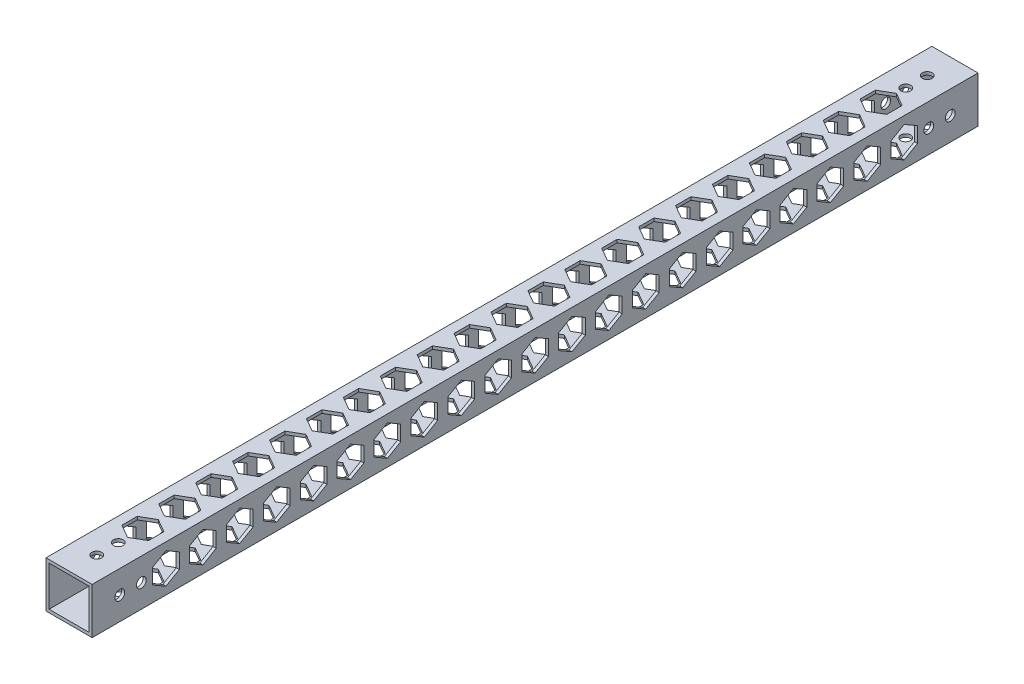
from build123d import *

# Parameters (mm, degrees)
SKETCH_1_W          = 15
SKETCH_1_H          = 15
SKETCH_1_W_2        = 13
SKETCH_1_H_2        = 13
EXTRUDE_1_DEPTH     = 288
SKETCH_2_R          = 1.6
CUT_EXTRUDE_1_DEPTH = 15
SKETCH_3_R          = 1.6
CUT_EXTRUDE_2_DEPTH = 15


with BuildPart() as part:
    # 草图1 → 凸台-拉伸1 (new body)
    with BuildSketch(Plane.XY):
        Rectangle(SKETCH_1_W, SKETCH_1_H)
        Rectangle(SKETCH_1_W_2, SKETCH_1_H_2, mode=Mode.SUBTRACT)
    extrude(amount=EXTRUDE_1_DEPTH)

    # 草图2 → 切除-拉伸1 (cut)
    with BuildSketch(Plane(origin=(0, 7.5, 0), x_dir=(1, 0, 0), z_dir=(0, 1, 0))):
        with Locations(Location((0, -9, 0), (0, 0, 180))):
            Circle(SKETCH_2_R)
        with Locations(Location((0, -279, 0), (0, 0, 180))):
            Circle(SKETCH_2_R)
        with Locations(Location((0, -16, 0), (0, 0, 180))):
            Circle(SKETCH_2_R)
        with Locations(Location((0, -272, 0), (0, 0, 180))):
            Circle(SKETCH_2_R)
        Polygon((0, -151), (-4.330127019, -153.5), (-4.330127019, -158.5), (0, -161), (4.330127019, -158.5), (4.330127019, -153.5), align=None)
        Polygon((0, -139), (-4.330127019, -141.5), (-4.330127019, -146.5), (0, -149), (4.330127019, -146.5), (4.330127019, -141.5), align=None)
        Polygon((0, -163), (-4.330127019, -165.5), (-4.330127019, -170.5), (0, -173), (4.330127019, -170.5), (4.330127019, -165.5), align=None)
        Polygon((0, -175), (-4.330127019, -177.5), (-4.330127019, -182.5), (0, -185), (4.330127019, -182.5), (4.330127019, -177.5), align=None)
        Polygon((0, -187), (-4.330127019, -189.5), (-4.330127019, -194.5), (0, -197), (4.330127019, -194.5), (4.330127019, -189.5), align=None)
        Polygon((0, -199), (-4.330127019, -201.5), (-4.330127019, -206.5), (0, -209), (4.330127019, -206.5), (4.330127019, -201.5), align=None)
        Polygon((0, -211), (-4.330127019, -213.5), (-4.330127019, -218.5), (0, -221), (4.330127019, -218.5), (4.330127019, -213.5), align=None)
        Polygon((0, -223), (-4.330127019, -225.5), (-4.330127019, -230.5), (0, -233), (4.330127019, -230.5), (4.330127019, -225.5), align=None)
        Polygon((0, -235), (-4.330127019, -237.5), (-4.330127019, -242.5), (0, -245), (4.330127019, -242.5), (4.330127019, -237.5), align=None)
        Polygon((0, -247), (-4.330127019, -249.5), (-4.330127019, -254.5), (0, -257), (4.330127019, -254.5), (4.330127019, -249.5), align=None)
        Polygon((0, -259), (-4.330127019, -261.5), (-4.330127019, -266.5), (0, -269), (4.330127019, -266.5), (4.330127019, -261.5), align=None)
        Polygon((0, -127), (-4.330127019, -129.5), (-4.330127019, -134.5), (0, -137), (4.330127019, -134.5), (4.330127019, -129.5), align=None)
        Polygon((0, -115), (-4.330127019, -117.5), (-4.330127019, -122.5), (0, -125), (4.330127019, -122.5), (4.330127019, -117.5), align=None)
        Polygon((0, -103), (-4.330127019, -105.5), (-4.330127019, -110.5), (0, -113), (4.330127019, -110.5), (4.330127019, -105.5), align=None)
        Polygon((0, -91), (-4.330127019, -93.5), (-4.330127019, -98.5), (0, -101), (4.330127019, -98.5), (4.330127019, -93.5), align=None)
        Polygon((0, -79), (-4.330127019, -81.5), (-4.330127019, -86.5), (0, -89), (4.330127019, -86.5), (4.330127019, -81.5), align=None)
        Polygon((0, -67), (-4.330127019, -69.5), (-4.330127019, -74.5), (0, -77), (4.330127019, -74.5), (4.330127019, -69.5), align=None)
        Polygon((0, -55), (-4.330127019, -57.5), (-4.330127019, -62.5), (0, -65), (4.330127019, -62.5), (4.330127019, -57.5), align=None)
        Polygon((0, -43), (-4.330127019, -45.5), (-4.330127019, -50.5), (0, -53), (4.330127019, -50.5), (4.330127019, -45.5), align=None)
        Polygon((0, -31), (-4.330127019, -33.5), (-4.330127019, -38.5), (0, -41), (4.330127019, -38.5), (4.330127019, -33.5), align=None)
        Polygon((0, -19), (-4.330127019, -21.5), (-4.330127019, -26.5), (0, -29), (4.330127019, -26.5), (4.330127019, -21.5), align=None)
    extrude(amount=-CUT_EXTRUDE_1_DEPTH, mode=Mode.SUBTRACT)

    # 草图3 → 切除-拉伸2 (cut)
    with BuildSketch(Plane.ZY.offset(7.5)):
        with Locations((9, 0)):
            Circle(SKETCH_3_R)
        with Locations((279, 0)):
            Circle(SKETCH_3_R)
        with Locations((272, 0)):
            Circle(SKETCH_3_R)
        with Locations((16, 0)):
            Circle(SKETCH_3_R)
        Polygon((156, 5), (151.669872981, 2.5), (151.669872981, -2.5), (156, -5), (160.330127019, -2.5), (160.330127019, 2.5), align=None)
        Polygon((144, 5), (139.669872981, 2.5), (139.669872981, -2.5), (144, -5), (148.330127019, -2.5), (148.330127019, 2.5), align=None)
        Polygon((168, 5), (163.669872981, 2.5), (163.669872981, -2.5), (168, -5), (172.330127019, -2.5), (172.330127019, 2.5), align=None)
        Polygon((180, 5), (175.669872981, 2.5), (175.669872981, -2.5), (180, -5), (184.330127019, -2.5), (184.330127019, 2.5), align=None)
        Polygon((192, 5), (187.669872981, 2.5), (187.669872981, -2.5), (192, -5), (196.330127019, -2.5), (196.330127019, 2.5), align=None)
        Polygon((204, 5), (199.669872981, 2.5), (199.669872981, -2.5), (204, -5), (208.330127019, -2.5), (208.330127019, 2.5), align=None)
        Polygon((216, 5), (211.669872981, 2.5), (211.669872981, -2.5), (216, -5), (220.330127019, -2.5), (220.330127019, 2.5), align=None)
        Polygon((228, 5), (223.669872981, 2.5), (223.669872981, -2.5), (228, -5), (232.330127019, -2.5), (232.330127019, 2.5), align=None)
        Polygon((240, 5), (235.669872981, 2.5), (235.669872981, -2.5), (240, -5), (244.330127019, -2.5), (244.330127019, 2.5), align=None)
        Polygon((252, 5), (247.669872981, 2.5), (247.669872981, -2.5), (252, -5), (256.330127019, -2.5), (256.330127019, 2.5), align=None)
        Polygon((264, 5), (259.669872981, 2.5), (259.669872981, -2.5), (264, -5), (268.330127019, -2.5), (268.330127019, 2.5), align=None)
        Polygon((132, 5), (127.669872981, 2.5), (127.669872981, -2.5), (132, -5), (136.330127019, -2.5), (136.330127019, 2.5), align=None)
        Polygon((120, 5), (115.669872981, 2.5), (115.669872981, -2.5), (120, -5), (124.330127019, -2.5), (124.330127019, 2.5), align=None)
        Polygon((108, 5), (103.669872981, 2.5), (103.669872981, -2.5), (108, -5), (112.330127019, -2.5), (112.330127019, 2.5), align=None)
        Polygon((96, 5), (91.669872981, 2.5), (91.669872981, -2.5), (96, -5), (100.330127019, -2.5), (100.330127019, 2.5), align=None)
        Polygon((84, 5), (79.669872981, 2.5), (79.669872981, -2.5), (84, -5), (88.330127019, -2.5), (88.330127019, 2.5), align=None)
        Polygon((72, 5), (67.669872981, 2.5), (67.669872981, -2.5), (72, -5), (76.330127019, -2.5), (76.330127019, 2.5), align=None)
        Polygon((60, 5), (55.669872981, 2.5), (55.669872981, -2.5), (60, -5), (64.330127019, -2.5), (64.330127019, 2.5), align=None)
        Polygon((48, 5), (43.669872981, 2.5), (43.669872981, -2.5), (48, -5), (52.330127019, -2.5), (52.330127019, 2.5), align=None)
        Polygon((36, 5), (31.669872981, 2.5), (31.669872981, -2.5), (36, -5), (40.330127019, -2.5), (40.330127019, 2.5), align=None)
        Polygon((24, 5), (19.669872981, 2.5), (19.669872981, -2.5), (24, -5), (28.330127019, -2.5), (28.330127019, 2.5), align=None)
    extrude(amount=-CUT_EXTRUDE_2_DEPTH, mode=Mode.SUBTRACT)


solid = part.part
